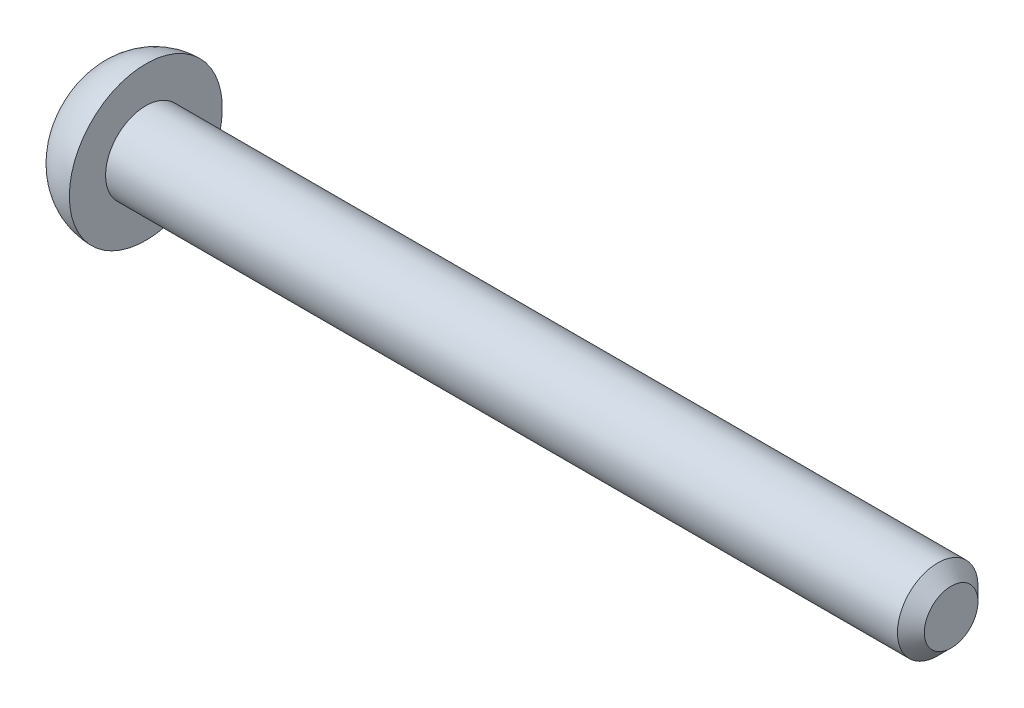
from build123d import *

# Parameters (mm, degrees)
CHAMFER1_SIZE      = 0.5
CUT_EXTRUDE1_DEPTH = 1


with BuildPart() as part:
    # Sketch2 → Revolve1 (revolve)
    with BuildSketch(Plane(origin=(0, 0, 0), x_dir=(1, 0, 0), z_dir=(0, 1, 0)), mode=Mode.PRIVATE) as revolve1_sk:
        with BuildLine():
            Line((0, 0), (0, 1.5))
            Line((0, 1.5), (-30, 1.5))
            Line((-30, 1.5), (-30, 2.85))
            ThreePointArc((-30, 2.85), (-30.917065968, 2.639177072), (-31.65, 2.049038106))
            Line((-31.65, 2.049038106), (-31.65, 0))
            Line((-31.65, 0), (0, 0))
        make_face()
    revolve(revolve1_sk.sketch.rotate(Axis((-31.65, 0, 0), (1, 0, 0)), 180), axis=Axis((-31.65, 0, 0), (1, 0, 0)))

    # Chamfer1
    chamfer1_edges = [part.edges().sort_by_distance(p)[0] for p in [
        (0, 0, -1.5),
    ]]
    chamfer(chamfer1_edges, length=CHAMFER1_SIZE)

    # Sketch4 → Cut-Extrude1 (cut)
    with BuildSketch(Plane.ZY.offset(31.65)):
        with BuildLine():
            ThreePointArc((-1.342027284, 0.090739778), (-0.883315009, 0.509982158), (-0.749596595, 1.116859832))
            ThreePointArc((-0.749596595, 1.116859832), (-0.7, 1.212435565), (-0.592430689, 1.20759961))
            ThreePointArc((-0.592430689, 1.20759961), (0, 1.019964317), (0.592430689, 1.20759961))
            ThreePointArc((0.592430689, 1.20759961), (0.7, 1.212435565), (0.749596595, 1.116859832))
            ThreePointArc((0.749596595, 1.116859832), (0.883315009, 0.509982158), (1.342027284, 0.090739778))
            ThreePointArc((1.342027284, 0.090739778), (1.4, 0), (1.342027284, -0.090739778))
            ThreePointArc((1.342027284, -0.090739778), (0.883315009, -0.509982158), (0.749596595, -1.116859832))
            ThreePointArc((0.749596595, -1.116859832), (0.7, -1.212435565), (0.592430689, -1.20759961))
            ThreePointArc((0.592430689, -1.20759961), (0, -1.019964317), (-0.592430689, -1.20759961))
            ThreePointArc((-0.592430689, -1.20759961), (-0.7, -1.212435565), (-0.749596595, -1.116859832))
            ThreePointArc((-0.749596595, -1.116859832), (-0.883315009, -0.509982158), (-1.342027284, -0.090739778))
            ThreePointArc((-1.342027284, -0.090739778), (-1.4, 0), (-1.342027284, 0.090739778))
        make_face()
    extrude(amount=-CUT_EXTRUDE1_DEPTH, mode=Mode.SUBTRACT)


solid = part.part
